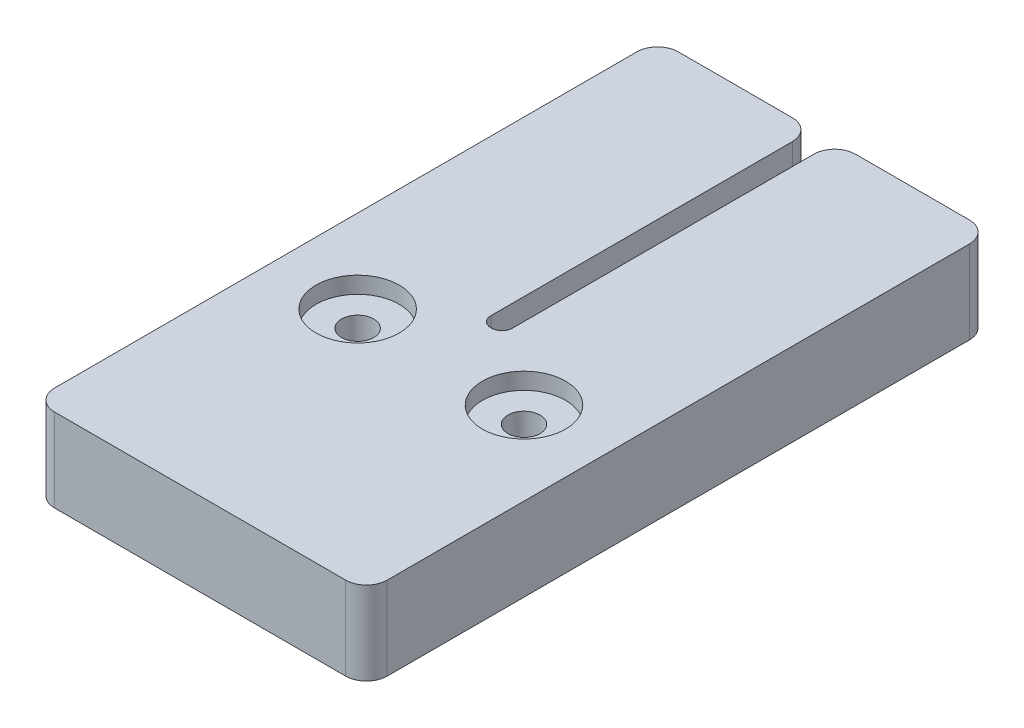
from build123d import *

# Parameters (mm, degrees)
BOSS_EXTRUDE1_DEPTH = 12.7
FILLET1_R           = 3.175
FILLET2_R           = 1.5875
SKETCH2_R           = 2.45745
CUT_EXTRUDE1_DEPTH  = 100.3932216
SKETCH3_R           = 6.35
CUT_EXTRUDE2_DEPTH  = 2.54


with BuildPart() as part:
    # Sketch1 → Boss-Extrude1 (new body)
    with BuildSketch(Plane(origin=(0, 0, 0), x_dir=(1, 0, 0), z_dir=(0, 1, 0))):
        Polygon((-25.4, 0), (25.4, 0), (25.4, 95.25), (1.651, 95.25), (1.651, 44.45), (-1.651, 44.45), (-1.651, 95.25), (-25.4, 95.25), align=None)
    extrude(amount=BOSS_EXTRUDE1_DEPTH)

    # Fillet1
    fillet1_edges = [part.edges().sort_by_distance(p)[0] for p in [
        (-25.4, 6.35, -95.25),
        (-1.651, 6.35, -95.25),
        (1.651, 6.35, -95.25),
        (25.4, 6.35, -95.25),
        (25.4, 6.35, 0),
        (-25.4, 6.35, 0),
    ]]
    fillet(fillet1_edges, radius=FILLET1_R)

    # Fillet2
    fillet2_edges = [part.edges().sort_by_distance(p)[0] for p in [
        (-1.651, 6.35, -44.45),
        (1.651, 6.35, -44.45),
    ]]
    fillet(fillet2_edges, radius=FILLET2_R)

    # Sketch2 → Cut-Extrude1 (cut, through all)
    with BuildSketch(Plane.XZ):
        with Locations(Location((-12.7, -36.7538, 0), (0, 0, 270))):
            Circle(SKETCH2_R)
        with Locations(Location((12.7, -36.7538, 0), (0, 0, 270))):
            Circle(SKETCH2_R)
    extrude(amount=-CUT_EXTRUDE1_DEPTH, mode=Mode.SUBTRACT)

    # Sketch3 → Cut-Extrude2 (cut)
    with BuildSketch(Plane(origin=(0, 12.7, 0), x_dir=(1, 0, 0), z_dir=(0, 1, 0))):
        with Locations(Location((12.7, 36.7538, 0), (0, 0, 270))):
            Circle(SKETCH3_R)
        with Locations(Location((-12.7, 36.7538, 0), (0, 0, 270))):
            Circle(SKETCH3_R)
    extrude(amount=-CUT_EXTRUDE2_DEPTH, mode=Mode.SUBTRACT)


solid = part.part
